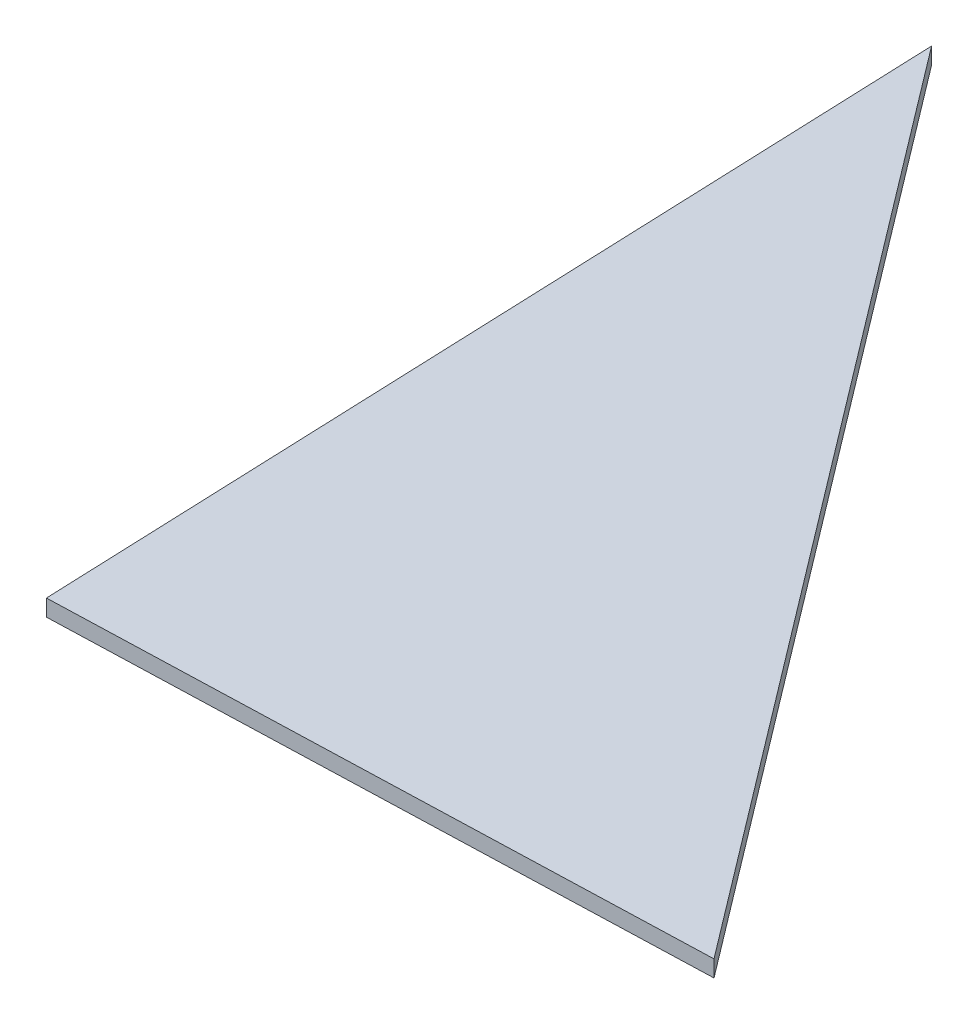
from build123d import *

# Parameters (mm, degrees)
BOSS_EXTRUDE1_DEPTH = 2.286


with BuildPart() as part:
    # Sketch1 → Boss-Extrude1 (new body)
    with BuildSketch(Plane(origin=(0, 0, 0), x_dir=(1, 0, 0), z_dir=(0, 1, 0))):
        Polygon((0, 0), (4.894026975, -127), (94.048026975, -124.063583815), align=None)
    extrude(amount=BOSS_EXTRUDE1_DEPTH)


solid = part.part
